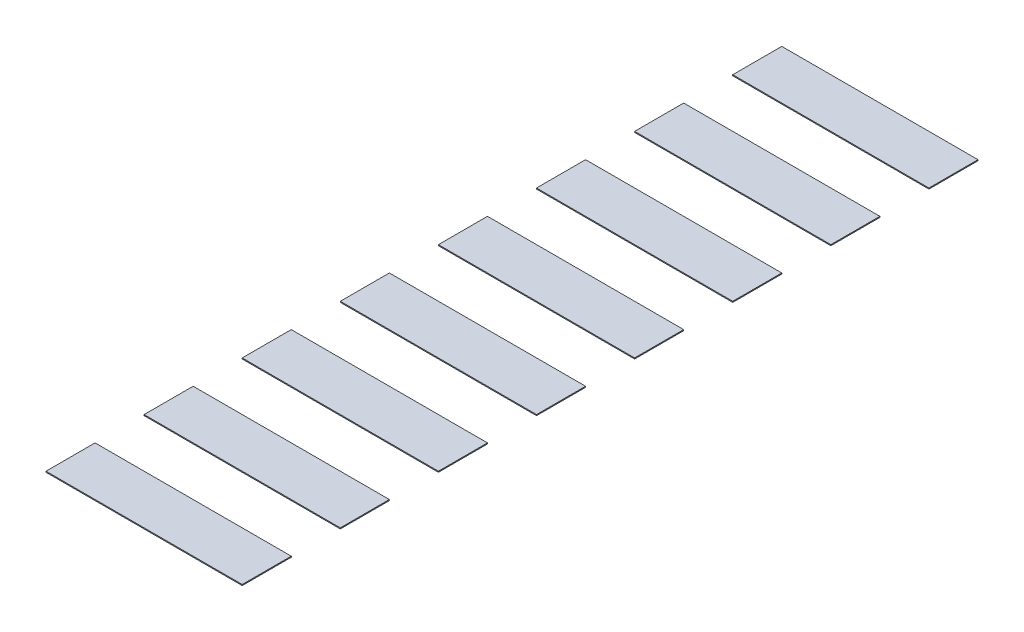
from build123d import *

# Parameters (mm, degrees)
SKETCH_1_W        = 100
SKETCH_1_H        = 25
EXTRUDE_1_DEPTH   = 0.5
EXTRUDE_1_2_DEPTH = 0.5
EXTRUDE_1_3_DEPTH = 0.5
EXTRUDE_1_4_DEPTH = 0.5
EXTRUDE_1_5_DEPTH = 0.5
EXTRUDE_1_6_DEPTH = 0.5
EXTRUDE_1_7_DEPTH = 0.5
EXTRUDE_1_8_DEPTH = 0.5


with BuildPart() as part:
    # 草图1 → 凸台-拉伸1 (new body)
    with BuildSketch(Plane(origin=(0, 0, 0), x_dir=(1, 0, 0), z_dir=(0, 1, 0))):
        with Locations((50, -62.5)):
            Rectangle(SKETCH_1_W, SKETCH_1_H)
    extrude(amount=EXTRUDE_1_DEPTH)


with BuildPart() as body_2:
    # 草图1 → Extrude 1 2 (new body)
    with BuildSketch(Plane(origin=(0, 0, 0), x_dir=(1, 0, 0), z_dir=(0, 1, 0))):
        with Locations((50, -12.5)):
            Rectangle(SKETCH_1_W, SKETCH_1_H)
    extrude(amount=EXTRUDE_1_2_DEPTH)


with BuildPart() as body_3:
    # 草图1 → Extrude 1 3 (new body)
    with BuildSketch(Plane(origin=(0, 0, 0), x_dir=(1, 0, 0), z_dir=(0, 1, 0))):
        with Locations((50, -162.5)):
            Rectangle(SKETCH_1_W, SKETCH_1_H)
    extrude(amount=EXTRUDE_1_3_DEPTH)


with BuildPart() as body_4:
    # 草图1 → Extrude 1 4 (new body)
    with BuildSketch(Plane(origin=(0, 0, 0), x_dir=(1, 0, 0), z_dir=(0, 1, 0))):
        with Locations((50, -112.5)):
            Rectangle(SKETCH_1_W, SKETCH_1_H)
    extrude(amount=EXTRUDE_1_4_DEPTH)


with BuildPart() as body_5:
    # 草图1 → Extrude 1 5 (new body)
    with BuildSketch(Plane(origin=(0, 0, 0), x_dir=(1, 0, 0), z_dir=(0, 1, 0))):
        with Locations((50, -362.5)):
            Rectangle(SKETCH_1_W, SKETCH_1_H)
    extrude(amount=EXTRUDE_1_5_DEPTH)


with BuildPart() as body_6:
    # 草图1 → Extrude 1 6 (new body)
    with BuildSketch(Plane(origin=(0, 0, 0), x_dir=(1, 0, 0), z_dir=(0, 1, 0))):
        with Locations((50, -212.5)):
            Rectangle(SKETCH_1_W, SKETCH_1_H)
    extrude(amount=EXTRUDE_1_6_DEPTH)


with BuildPart() as body_7:
    # 草图1 → Extrude 1 7 (new body)
    with BuildSketch(Plane(origin=(0, 0, 0), x_dir=(1, 0, 0), z_dir=(0, 1, 0))):
        with Locations((50, -262.5)):
            Rectangle(SKETCH_1_W, SKETCH_1_H)
    extrude(amount=EXTRUDE_1_7_DEPTH)


with BuildPart() as body_8:
    # 草图1 → Extrude 1 8 (new body)
    with BuildSketch(Plane(origin=(0, 0, 0), x_dir=(1, 0, 0), z_dir=(0, 1, 0))):
        with Locations((50, -312.5)):
            Rectangle(SKETCH_1_W, SKETCH_1_H)
    extrude(amount=EXTRUDE_1_8_DEPTH)


solid = Compound([part.part, body_2.part, body_3.part, body_4.part, body_5.part, body_6.part, body_7.part, body_8.part])
